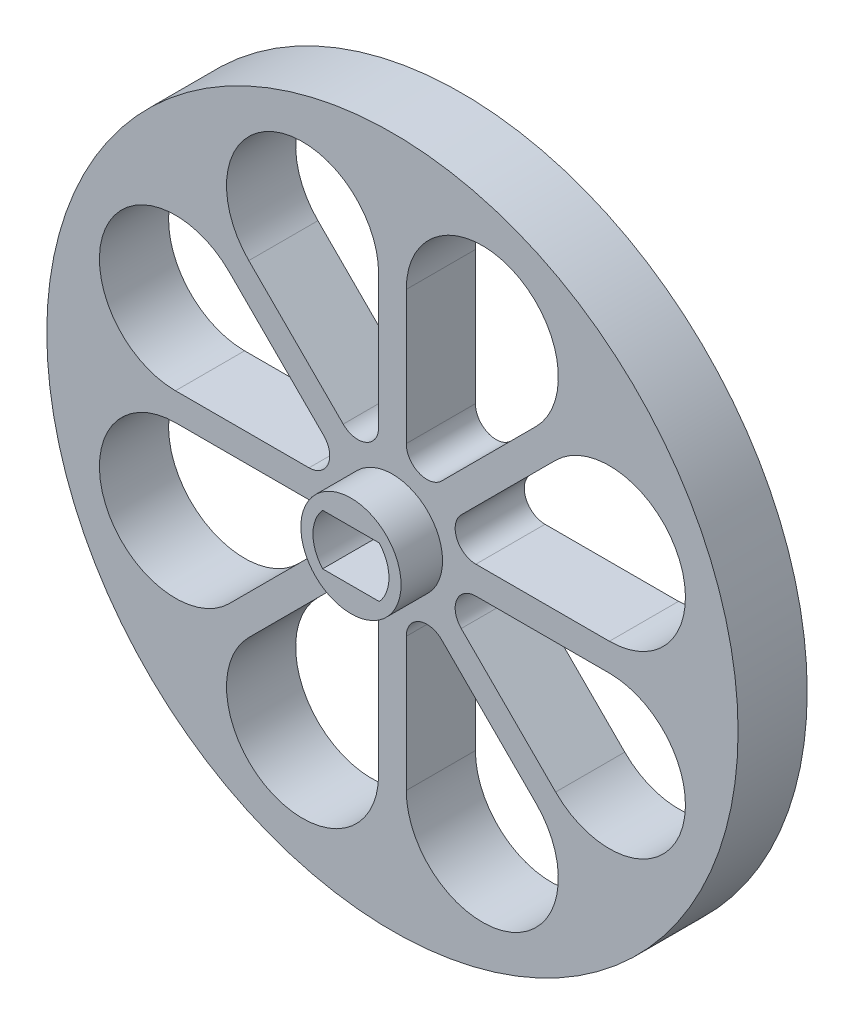
from build123d import *

# Parameters (mm, degrees)
SKETCH1_W           = 25
SKETCH1_H           = 5
SKETCH2_R           = 3.625
BOSS_EXTRUDE1_DEPTH = 3
CUT_EXTRUDE1_DEPTH  = 37.463627082
CUT_EXTRUDE2_DEPTH  = 36.924867432
CUT_EXTRUDE3_DEPTH  = 36.924867432
CUT_EXTRUDE4_DEPTH  = 36.924867432
CUT_EXTRUDE5_DEPTH  = 36.924867432
CUT_EXTRUDE6_DEPTH  = 36.924867432
CUT_EXTRUDE7_DEPTH  = 36.924867432
CUT_EXTRUDE8_DEPTH  = 36.924867432
CUT_EXTRUDE9_DEPTH  = 37.463627082


with BuildPart() as part:
    # Sketch1 → Revolve1 (revolve)
    with BuildSketch(Plane(origin=(0, 0, 0), x_dir=(1, 0, 0), z_dir=(0, 1, 0))):
        with Locations((12.19, 88.3)):
            Rectangle(SKETCH1_W, SKETCH1_H)
    revolve(axis=Axis((-0.31, 0, -90.8), (0, 0, 1)))

    # Sketch2 → Boss-Extrude1 (add)
    with BuildSketch(Plane.XY.offset(-85.8)):
        with Locations((-0.31, 0)):
            Circle(SKETCH2_R)
    extrude(amount=BOSS_EXTRUDE1_DEPTH)

    # Sketch3 → Cut-Extrude1 (cut, through all)
    with BuildSketch(Plane(origin=(0, 0, -90.8), x_dir=(-1, 0, 0), z_dir=(0, 0, -1))):
        with BuildLine():
            Line((-1.738954013, -1.834199404), (2.358954013, -1.834199404))
            ThreePointArc((2.358954013, -1.834199404), (3.06, 0), (2.358954013, 1.834199404))
            Line((2.358954013, 1.834199404), (-1.738954013, 1.834199404))
            ThreePointArc((-1.738954013, 1.834199404), (-2.44, 0), (-1.738954013, -1.834199404))
        make_face()
    extrude(amount=-CUT_EXTRUDE1_DEPTH, mode=Mode.SUBTRACT)

    # Sketch4 → Cut-Extrude2 (cut, through all)
    with BuildSketch(Plane.XY.offset(-85.8)):
        with BuildLine():
            Line((5.725533906, 1), (15.382388155, 1))
            ThreePointArc((15.382388155, 1), (20.463725584, 8.604758878), (11.493300859, 10.389087297))
            Line((11.493300859, 10.389087297), (4.664873734, 3.560660172))
            ThreePointArc((4.664873734, 3.560660172), (4.339714607, 1.925974851), (5.725533906, 1))
        make_face()
    extrude(amount=-CUT_EXTRUDE2_DEPTH, mode=Mode.SUBTRACT)

    # Sketch5 → Cut-Extrude3 (cut, through all)
    with BuildSketch(Plane.XY.offset(-85.8)):
        with BuildLine():
            Line((-12.113300859, -10.389087297), (-5.284873734, -3.560660172))
            ThreePointArc((-5.284873734, -3.560660172), (-4.959714607, -1.925974851), (-6.345533906, -1))
            Line((-6.345533906, -1), (-16.002388155, -1))
            ThreePointArc((-16.002388155, -1), (-21.083725584, -8.604758878), (-12.113300859, -10.389087297))
        make_face()
    extrude(amount=-CUT_EXTRUDE3_DEPTH, mode=Mode.SUBTRACT)

    # Sketch6 → Cut-Extrude4 (cut, through all)
    with BuildSketch(Plane.XY.offset(-85.8)):
        with BuildLine():
            Line((3.250660172, 4.974873734), (10.079087297, 11.803300859))
            ThreePointArc((10.079087297, 11.803300859), (8.294758878, 20.773725584), (0.69, 15.692388155))
            Line((0.69, 15.692388155), (0.69, 6.035533906))
            ThreePointArc((0.69, 6.035533906), (1.615974851, 4.649714607), (3.250660172, 4.974873734))
        make_face()
    extrude(amount=-CUT_EXTRUDE4_DEPTH, mode=Mode.SUBTRACT)

    # Sketch7 → Cut-Extrude5 (cut, through all)
    with BuildSketch(Plane.XY.offset(-85.8)):
        with BuildLine():
            Line((-3.870660172, -4.974873734), (-10.699087297, -11.803300859))
            ThreePointArc((-10.699087297, -11.803300859), (-8.914758878, -20.773725584), (-1.31, -15.692388155))
            Line((-1.31, -15.692388155), (-1.31, -6.035533906))
            ThreePointArc((-1.31, -6.035533906), (-2.235974851, -4.649714607), (-3.870660172, -4.974873734))
        make_face()
    extrude(amount=-CUT_EXTRUDE5_DEPTH, mode=Mode.SUBTRACT)

    # Sketch8 → Cut-Extrude6 (cut, through all)
    with BuildSketch(Plane.XY.offset(-85.8)):
        with BuildLine():
            Line((15.382388155, -1), (5.725533906, -1))
            ThreePointArc((5.725533906, -1), (4.339714607, -1.925974851), (4.664873734, -3.560660172))
            Line((4.664873734, -3.560660172), (11.493300859, -10.389087297))
            ThreePointArc((11.493300859, -10.389087297), (20.463725584, -8.604758878), (15.382388155, -1))
        make_face()
    extrude(amount=-CUT_EXTRUDE6_DEPTH, mode=Mode.SUBTRACT)

    # Sketch9 → Cut-Extrude7 (cut, through all)
    with BuildSketch(Plane.XY.offset(-85.8)):
        with BuildLine():
            Line((-16.002388155, 1), (-6.345533906, 1))
            ThreePointArc((-6.345533906, 1), (-4.959714607, 1.925974851), (-5.284873734, 3.560660172))
            Line((-5.284873734, 3.560660172), (-12.113300859, 10.389087297))
            ThreePointArc((-12.113300859, 10.389087297), (-21.083725584, 8.604758878), (-16.002388155, 1))
        make_face()
    extrude(amount=-CUT_EXTRUDE7_DEPTH, mode=Mode.SUBTRACT)

    # Sketch10 → Cut-Extrude8 (cut, through all)
    with BuildSketch(Plane.XY.offset(-85.8)):
        with BuildLine():
            Line((-1.31, 6.035533906), (-1.31, 15.692388155))
            ThreePointArc((-1.31, 15.692388155), (-8.914758878, 20.773725584), (-10.699087297, 11.803300859))
            Line((-10.699087297, 11.803300859), (-3.870660172, 4.974873734))
            ThreePointArc((-3.870660172, 4.974873734), (-2.235974851, 4.649714607), (-1.31, 6.035533906))
        make_face()
    extrude(amount=-CUT_EXTRUDE8_DEPTH, mode=Mode.SUBTRACT)

    # Sketch11 → Cut-Extrude9 (cut, through all)
    with BuildSketch(Plane(origin=(0, 0, -90.8), x_dir=(-1, 0, 0), z_dir=(0, 0, -1))):
        with BuildLine():
            Line((-0.69, -15.692388155), (-0.69, -6.035533906))
            ThreePointArc((-0.69, -6.035533906), (-1.615974851, -4.649714607), (-3.250660172, -4.974873734))
            Line((-3.250660172, -4.974873734), (-10.079087297, -11.803300859))
            ThreePointArc((-10.079087297, -11.803300859), (-8.294758878, -20.773725584), (-0.69, -15.692388155))
        make_face()
    extrude(amount=-CUT_EXTRUDE9_DEPTH, mode=Mode.SUBTRACT)


solid = part.part
